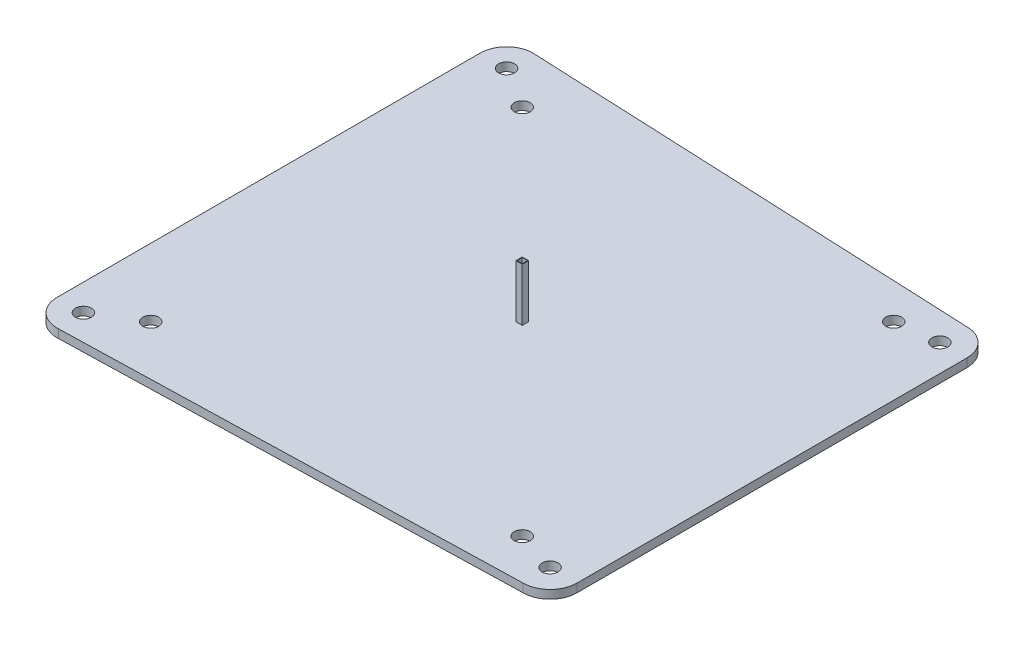
from build123d import *

# Parameters (mm, degrees)
SKETCH1_W           = 95.89
SKETCH1_H           = 90.17
SUBSTRATE_DEPTH     = 1.6
SKETCH2_R           = 1.5
CUT_EXTRUDE2_DEPTH  = 10
SKETCH3_W           = 1.2
SKETCH3_H           = 1.2
SKETCH3_W_2         = 1
SKETCH3_H_2         = 1
BOSS_EXTRUDE1_DEPTH = 10
SKETCH4_OUTSIDE_W   = 124.318
SKETCH4_OUTSIDE_H   = 118.598
CUT_EXTRUDE3_DEPTH  = 10
SKETCH5_R           = 1.5
CUT_EXTRUDE4_DEPTH  = 10


with BuildPart() as part:
    # Sketch1 → Substrate (new body)
    with BuildSketch(Plane(origin=(0, 0, 0), x_dir=(1, 0, 0), z_dir=(0, 1, 0))):
        Rectangle(SKETCH1_W, SKETCH1_H)
    extrude(amount=SUBSTRATE_DEPTH)

    # Sketch2 → Cut-Extrude2 (cut)
    with BuildSketch(Plane(origin=(0, 1.6, 0), x_dir=(1, 0, 0), z_dir=(0, 1, 0))):
        with Locations(Location((42.845, 36.085, 0), (0, 0, 270))):
            Circle(SKETCH2_R)
        with Locations(Location((42.845, -37.585, 0), (0, 0, 270))):
            Circle(SKETCH2_R)
        with Locations(Location((-42.945, -39.985, 0), (0, 0, 270))):
            Circle(SKETCH2_R)
        with Locations(Location((-42.945, 39.985, 0), (0, 0, 270))):
            Circle(SKETCH2_R)
    extrude(amount=-CUT_EXTRUDE2_DEPTH, mode=Mode.SUBTRACT)

    # Sketch3 → Boss-Extrude1 (add)
    with BuildSketch(Plane(origin=(0, 1.6, 0), x_dir=(1, 0, 0), z_dir=(0, 1, 0))):
        Rectangle(SKETCH3_W, SKETCH3_H)
        Rectangle(SKETCH3_W_2, SKETCH3_H_2, mode=Mode.SUBTRACT)
    extrude(amount=BOSS_EXTRUDE1_DEPTH)

    # Sketch4 outside → Cut-Extrude3 (cut)
    with BuildSketch(Plane(origin=(0, 1.6, 0), x_dir=(1, 0, 0), z_dir=(0, 1, 0))):
        Rectangle(SKETCH4_OUTSIDE_W, SKETCH4_OUTSIDE_H)
        with BuildLine():
            Line((-42.677096043, -44.977817588), (42.845, -42.685))
            ThreePointArc((42.845, -42.685), (46.451244584, -41.191244584), (47.945, -37.585))
            Line((47.945, -37.585), (47.945, 36.085))
            ThreePointArc((47.945, 36.085), (46.451244584, 39.691244584), (42.845, 41.185))
            Line((42.845, 41.185), (-42.502925272, 44.965418651))
            ThreePointArc((-42.502925272, 44.965418651), (-46.320620414, 43.673520953), (-47.945, 39.985))
            Line((-47.945, 39.985), (-47.945, -39.985))
            ThreePointArc((-47.945, -39.985), (-46.384511609, -43.614016381), (-42.677096043, -44.977817588))
        make_face(mode=Mode.SUBTRACT)
    extrude(amount=-CUT_EXTRUDE3_DEPTH, mode=Mode.SUBTRACT)

    # Sketch5 → Cut-Extrude4 (cut)
    with BuildSketch(Plane(origin=(0, 1.6, 0), x_dir=(1, 0, 0), z_dir=(0, 1, 0))):
        with Locations(Location((-35.1, 35.1, 0), (0, 0, 270))):
            Circle(SKETCH5_R)
        with Locations(Location((35.1, 35.1, 0), (0, 0, 270))):
            Circle(SKETCH5_R)
        with Locations(Location((35.1, -35.1, 0), (0, 0, 270))):
            Circle(SKETCH5_R)
        with Locations(Location((-35.1, -35.1, 0), (0, 0, 270))):
            Circle(SKETCH5_R)
    extrude(amount=-CUT_EXTRUDE4_DEPTH, mode=Mode.SUBTRACT)


solid = part.part
